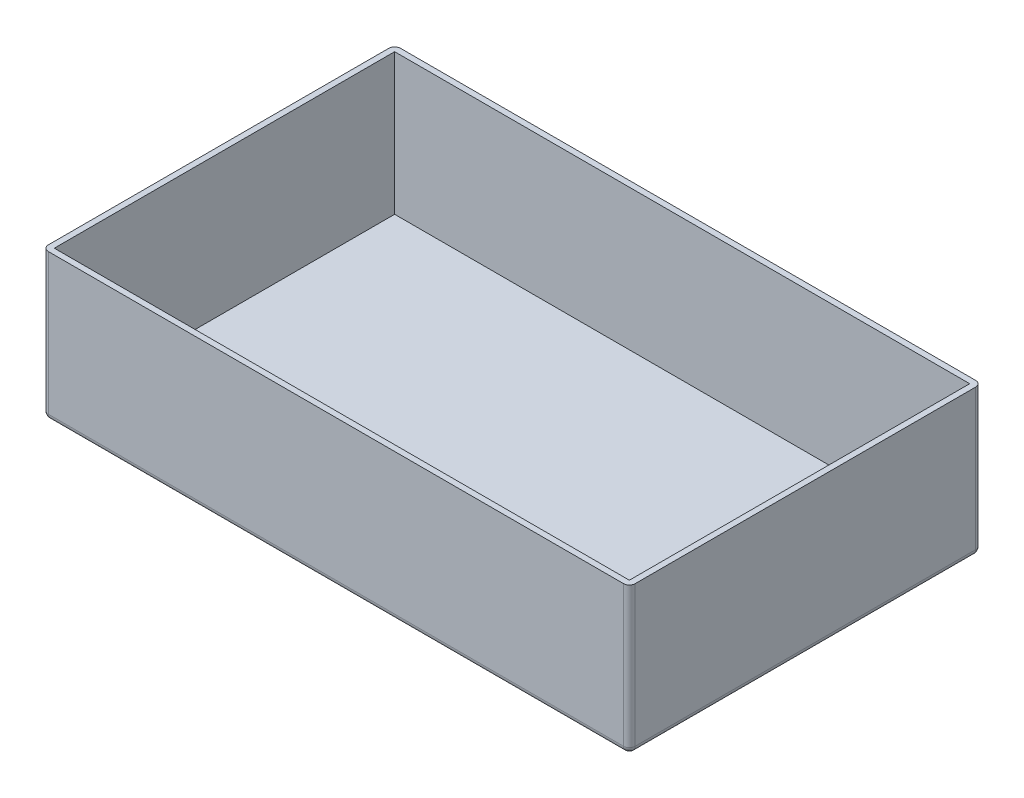
from build123d import *

# Parameters (mm, degrees)
SKETCH1_W           = 200
SKETCH1_H           = 120
BOSS_EXTRUDE1_DEPTH = 50
SHELL2_T            = -2
FILLET1_R           = 2


with BuildPart() as part:
    # Sketch1 → Boss-Extrude1 (new body)
    with BuildSketch(Plane(origin=(0, 0, 0), x_dir=(1, 0, 0), z_dir=(0, 1, 0))):
        Rectangle(SKETCH1_W, SKETCH1_H)
    extrude(amount=BOSS_EXTRUDE1_DEPTH)

    # Shell2
    shell2_openings = [part.faces().sort_by_distance(p)[0] for p in [
        (0, 50, 0),
    ]]
    offset(amount=SHELL2_T, openings=shell2_openings, kind=Kind.INTERSECTION)

    # Fillet1
    fillet1_edges = [part.edges().sort_by_distance(p)[0] for p in [
        (0, 0, 60),
        (-100, 0, 0),
        (0, 0, -60),
        (100, 0, 0),
        (100, 25, 60),
        (-100, 25, 60),
        (-100, 25, -60),
        (100, 25, -60),
    ]]
    fillet(fillet1_edges, radius=FILLET1_R)


solid = part.part
